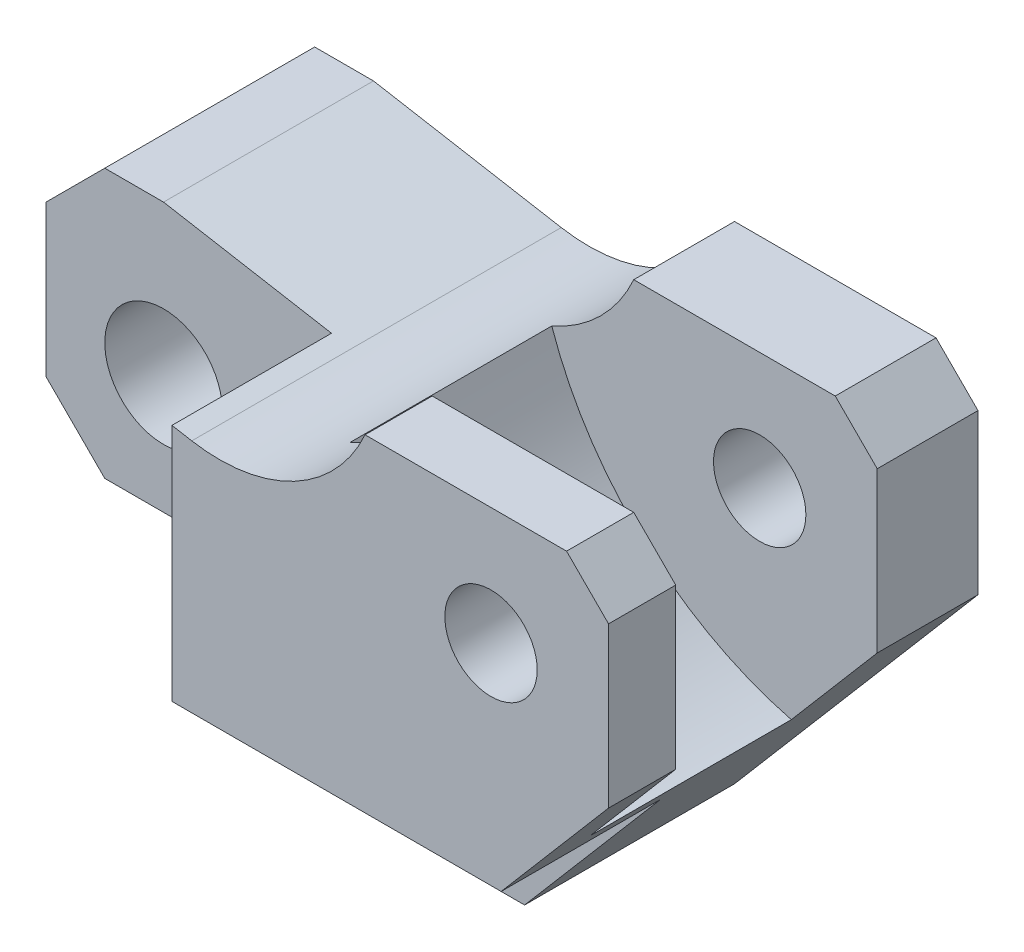
from build123d import *

# Parameters (mm, degrees)
SKETCH1_R               = 7
BOSS_EXTRUDE1_DEPTH     = 22
SKETCH2_R               = 7
CUT_EXTRUDE1_DEPTH      = 19
SKETCH2_3_R             = 5.5
CUT_EXTRUDE2_DEPTH      = 99.478424033
CUT_EXTRUDE3_DEPTH      = 14
CUT_EXTRUDE3_DEPTH_BACK = 10


with BuildPart() as part:
    # Sketch1 → Boss-Extrude1 (new, symmetric)
    with BuildSketch(Plane.XY):
        with BuildLine():
            Line((0, 0), (-7, 7))
            Line((-7, 7), (-7, 25))
            Line((-7, 25), (0, 32))
            Line((0, 32), (7, 32))
            Line((7, 32), (29.361380836, 28.057085233))
            ThreePointArc((29.361380836, 28.057085233), (41.561098706, 29.982044142), (50, 39))
            Line((50, 39), (74, 39))
            Line((74, 39), (79, 34))
            Line((79, 34), (79, 15))
            Line((79, 15), (50, -19))
            Line((50, -19), (44.296980053, -19))
            ThreePointArc((44.296980053, -19), (39.858007856, -12.115672061), (37.521177653, -4.264705882))
            ThreePointArc((37.521177653, -4.264705882), (35.840774692, -1.213413768), (32.575538911, 0))
            Line((32.575538911, 0), (0, 0))
        make_face()
        with Locations((7, 14)):
            Circle(SKETCH1_R, mode=Mode.SUBTRACT)
    extrude(amount=BOSS_EXTRUDE1_DEPTH, both=True)

    # Sketch2 → Cut-Extrude1 (cut)
    # profile 1 of 2: a face of its own
    with BuildSketch(Plane.XY.offset(22)):
        Polygon((24.613803159, 0), (27, 0), (27, 28.473460386), (7, 32), (0, 32), (-7, 25), (-7, 7), (0, 0), align=None)
        with Locations((7, 14)):
            Circle(SKETCH2_R, mode=Mode.SUBTRACT)
    # profile 2 of 2: a face of its own
    with BuildSketch(Plane.XY.offset(22)):
        with BuildLine():
            Line((66.205882353, 0), (32.575538911, 0))
            ThreePointArc((32.575538911, 0), (35.840774692, -1.213413768), (37.521177653, -4.264705882))
            ThreePointArc((37.521177653, -4.264705882), (39.858007856, -12.115672061), (44.296980053, -19))
            Line((44.296980053, -19), (50, -19))
            Line((50, -19), (66.205882353, 0))
        make_face()
    extrude(amount=-CUT_EXTRUDE1_DEPTH, mode=Mode.SUBTRACT)

    # Sketch2<3> → Cut-Extrude2 (cut, through all)
    with BuildSketch(Plane.XY.offset(22)):
        with Locations((65, 25)):
            Circle(SKETCH2_3_R)
    extrude(amount=-CUT_EXTRUDE2_DEPTH, mode=Mode.SUBTRACT)

    # Sketch3 → Cut-Extrude3 (cut, two sides: drawn at the far end of the back side and taken through both)
    with BuildSketch(Plane.XY.offset(-CUT_EXTRUDE3_DEPTH_BACK)):
        with BuildLine():
            Line((68.764705882, 3), (79, 15))
            Line((79, 15), (79, 34))
            Line((79, 34), (74, 39))
            Line((74, 39), (50, 39))
            ThreePointArc((50, 39), (46.021244343, 33.259333621), (40.236936549, 29.344294617))
            ThreePointArc((40.236936549, 29.344294617), (51.184262982, 12.580705229), (68.764705882, 3))
        make_face()
    extrude(amount=CUT_EXTRUDE3_DEPTH + CUT_EXTRUDE3_DEPTH_BACK, mode=Mode.SUBTRACT)


solid = part.part
